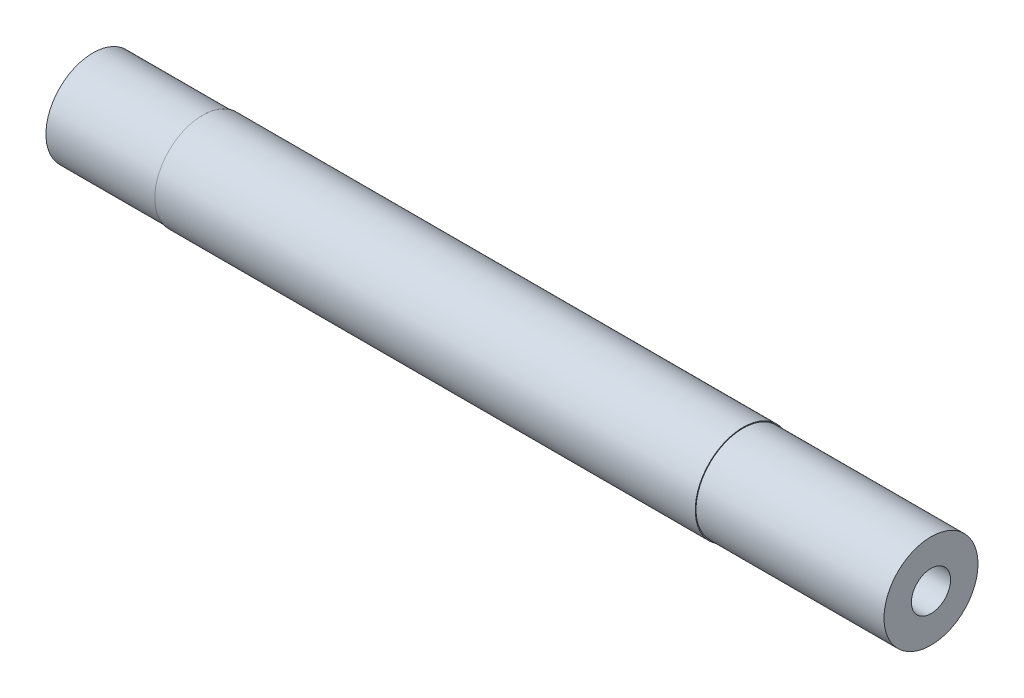
from build123d import *

# Parameters (mm, degrees)
ESBO_O1_R             = 1.25
CORTE_EXTRUS_O1_DEPTH = 10


with BuildPart() as part:
    # Sketch1 → Revolve1 (revolve)
    with BuildSketch(Plane(origin=(0, 0, 0), x_dir=(1, 0, 0), z_dir=(0, 1, 0))):
        Polygon((0, 0), (7, 0), (41.5, 0), (53.5, 0), (53.5, 3), (41.5, 3), (41.5, 3.05), (7, 3.05), (7, 3), (0, 3), align=None)
    revolve(axis=Axis((0, 0, 0), (-1, 0, 0)))

    # Esboço1 → Corte-extrusão1 (cut)
    with BuildSketch(Plane(origin=(53.5, 0, 0), x_dir=(0, 0, -1), z_dir=(1, 0, 0))):
        Circle(ESBO_O1_R)
    extrude(amount=-CORTE_EXTRUS_O1_DEPTH, mode=Mode.SUBTRACT)


solid = part.part
